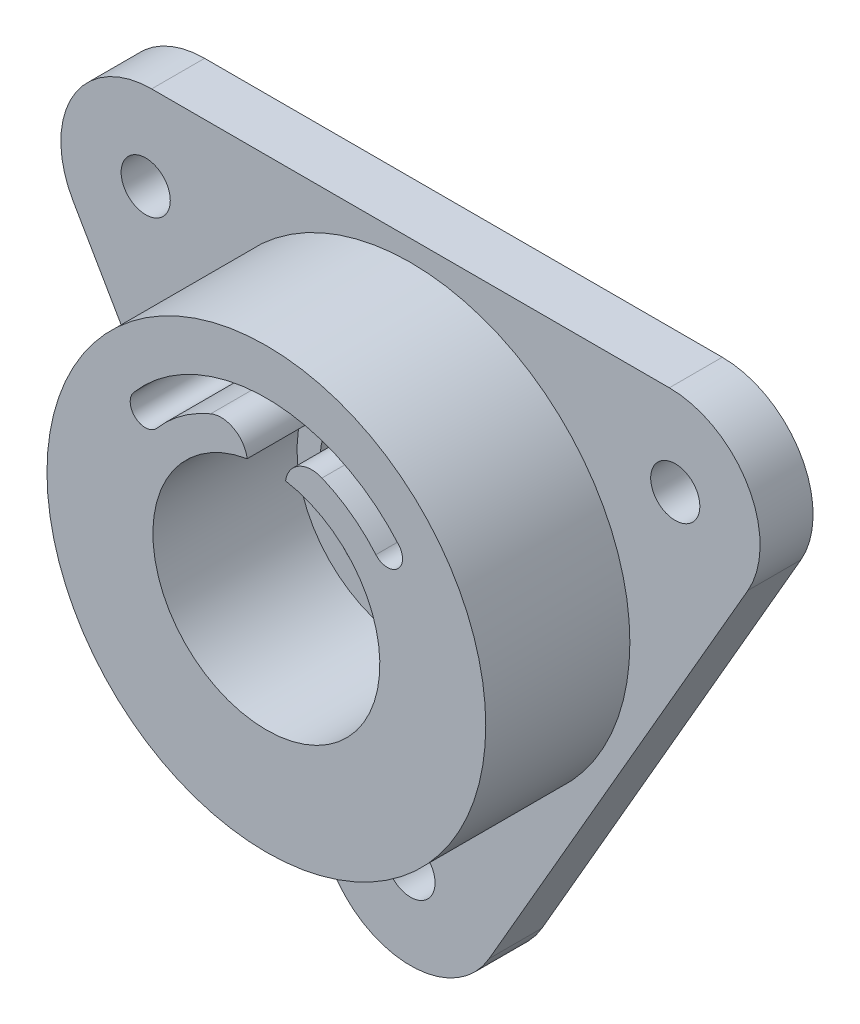
from build123d import *

# Parameters (mm, degrees)
ESQUISSE3_R             = 1.625
ESQUISSE3_R_2           = 6
BOSS_EXTRU_1_DEPTH      = 3.5
ESQUISSE4_R             = 14.5
ESQUISSE4_R_2           = 7.5
BOSS_EXTRU_2_DEPTH      = 9.525
CONG_3_R                = 6
ENL_V_MAT_EXTRU_1_DEPTH = 37.971588497
ENL_V_MAT_EXTRU_2_DEPTH = 37.971588497


with BuildPart() as part:
    # Esquisse3 → Boss.-Extru.1 (new body)
    with BuildSketch(Plane.XY):
        Polygon((0, -31.754264805), (-27.5, 15.877132403), (27.5, 15.877132403), align=None)
        with Locations((-17.5, 10.103629711)):
            Circle(ESQUISSE3_R, mode=Mode.SUBTRACT)
        with Locations((17.5, 10.103629711)):
            Circle(ESQUISSE3_R, mode=Mode.SUBTRACT)
        with Locations((0, -20.207259422)):
            Circle(ESQUISSE3_R, mode=Mode.SUBTRACT)
        Circle(ESQUISSE3_R_2, mode=Mode.SUBTRACT)
    extrude(amount=BOSS_EXTRU_1_DEPTH)

    # Esquisse4 → Boss.-Extru.2 (add)
    with BuildSketch(Plane.XY.offset(3.5)):
        Circle(ESQUISSE4_R)
        Circle(ESQUISSE4_R_2, mode=Mode.SUBTRACT)
    extrude(amount=BOSS_EXTRU_2_DEPTH)

    # Congé3
    cong_3_edges = [part.edges().sort_by_distance(p)[0] for p in [
        (0, -31.754264805, 1.75),
        (-27.5, 15.877132403, 1.75),
        (27.5, 15.877132403, 1.75),
    ]]
    fillet(cong_3_edges, radius=CONG_3_R)

    # Esquisse5 → Enlèv. mat.-Extru.1 (cut, through all)
    with BuildSketch(Plane.XY.offset(13.025)):
        with BuildLine():
            ThreePointArc((-7.238095238, 6.153046183), (0, 9.5), (7.238095238, 6.153046183))
            ThreePointArc((7.238095238, 6.153046183), (8.647689072, 6.038830492), (8.761904762, 7.448424326))
            ThreePointArc((8.761904762, 7.448424326), (0, 11.5), (-8.761904762, 7.448424326))
            ThreePointArc((-8.761904762, 7.448424326), (-8.647689072, 6.038830492), (-7.238095238, 6.153046183))
        make_face()
    extrude(amount=-ENL_V_MAT_EXTRU_1_DEPTH, mode=Mode.SUBTRACT)

    # Esquisse6 → Enlèv. mat.-Extru.2 (cut, through all)
    with BuildSketch(Plane.XY.offset(13.025)):
        with BuildLine():
            ThreePointArc((-2.322580645, 5.532234553), (-1.386431589, 7.823222319), (-3.677419355, 8.759371375))
            ThreePointArc((-3.677419355, 8.759371375), (0, 9.5), (3.677419355, 8.759371375))
            ThreePointArc((3.677419355, 8.759371375), (1.386431589, 7.823222319), (2.322580645, 5.532234553))
            ThreePointArc((2.322580645, 5.532234553), (0, 6), (-2.322580645, 5.532234553))
        make_face()
    extrude(amount=-ENL_V_MAT_EXTRU_2_DEPTH, mode=Mode.SUBTRACT)


solid = part.part
